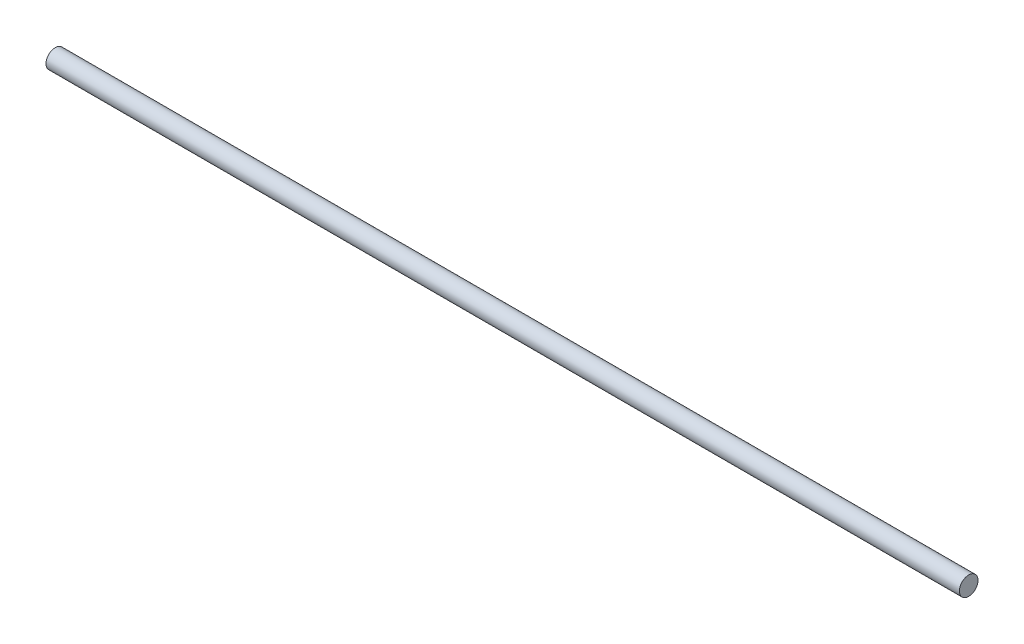
from build123d import *

# Parameters (mm, degrees)
SKETCH1_R           = 1.985
BOSS_EXTRUDE1_DEPTH = 97.5


with BuildPart() as part:
    # Sketch1 → Boss-Extrude1 (new, symmetric)
    with BuildSketch(Plane.YZ):
        with Locations(Location((0, 0, 0), (0, 0, 270))):
            Circle(SKETCH1_R)
    extrude(amount=BOSS_EXTRUDE1_DEPTH, both=True)


solid = part.part
